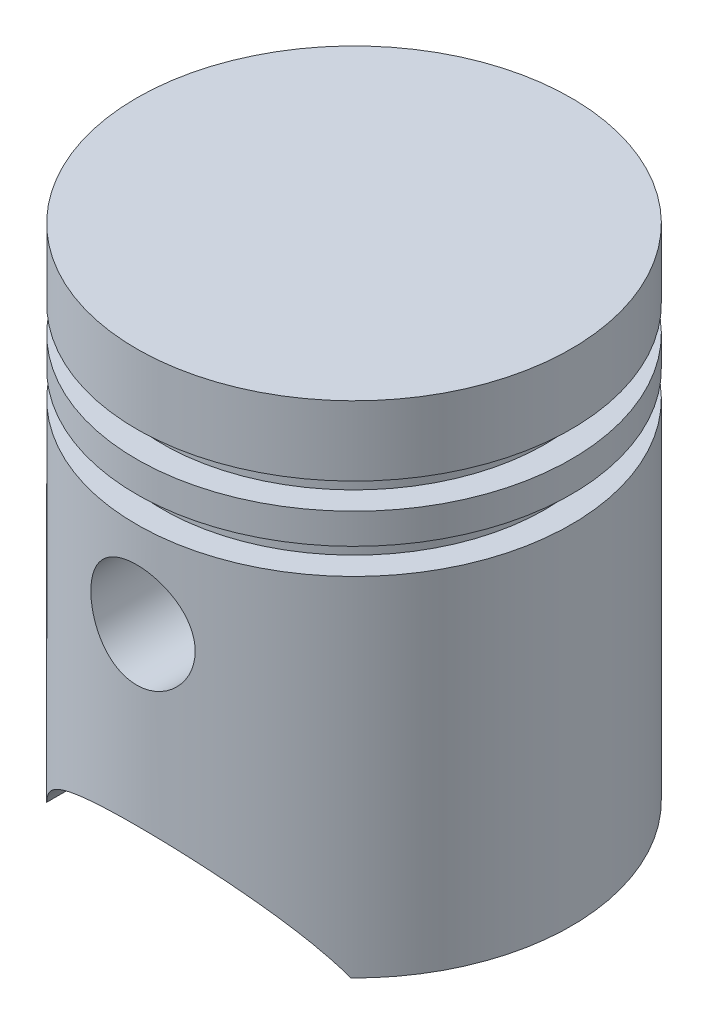
from build123d import *

# Parameters (mm, degrees)
CUT_EXTRUDE1_DEPTH       = 31.5
SKETCH3_R                = 6
CUT_EXTRUDE2_DEPTH       = 31.5
BOSS_EXTRUDE1_REACH      = 73.807
BOSS_EXTRUDE1_END_RADIUS = 23
SKETCH4_R                = 7.5
SKETCH4_R_2              = 6


with BuildPart() as part:
    # Sketch1 → Revolve1 (revolve)
    with BuildSketch(Plane.XY, mode=Mode.PRIVATE) as revolve1_sk:
        Polygon((23, 0), (25, 0), (25, 40), (22, 40), (22, 43), (25, 43), (25, 46.5), (22, 46.5), (22, 49.5), (25, 49.5), (25, 57.5), (0, 57.5), (0, 56.203662834), (23, 56.203662834), (23, 51.5), (20, 51.5), (20, 44.75), (20, 38), (23, 38), align=None)
    revolve(revolve1_sk.sketch.rotate(Axis((0, 63, 0), (0, -1, 0)), 180), axis=Axis((0, 63, 0), (0, -1, 0)))

    # Sketch2 → Cut-Extrude1 (cut, symmetric)
    with BuildSketch(Plane.XY):
        with BuildLine():
            Line((-17.5, 0), (17.5, 0))
            ThreePointArc((17.5, 0), (0, 10), (-17.5, 0))
        make_face()
    extrude(amount=CUT_EXTRUDE1_DEPTH, both=True, mode=Mode.SUBTRACT)

    # Sketch3 → Cut-Extrude2 (cut, symmetric)
    with BuildSketch(Plane.XY):
        with Locations((0, 30)):
            Circle(SKETCH3_R)
    extrude(amount=CUT_EXTRUDE2_DEPTH, both=True, mode=Mode.SUBTRACT)

    # Boss-Extrude1: up to this cylinder (the profile starts inside it)
    boss_extrude1_end = Plane(origin=(0, 30, 0), z_dir=(0, 1, 0)) * Cylinder(BOSS_EXTRUDE1_END_RADIUS, 194.614, mode=Mode.PRIVATE)
    # Sketch4 → Boss-Extrude1 (add, up to the surface)
    with BuildSketch(Plane.XY.offset(10), mode=Mode.PRIVATE) as boss_extrude1_sk1:
        with Locations(Location((0, 30, 0), (0, 0, 180))):
            Circle(SKETCH4_R)
        with Locations((0, 30)):
            Circle(SKETCH4_R_2, mode=Mode.SUBTRACT)
    boss_extrude1_tool1 = extrude(boss_extrude1_sk1.sketch, amount=BOSS_EXTRUDE1_REACH, mode=Mode.PRIVATE) & boss_extrude1_end
    boss_extrude1 = boss_extrude1_tool1.solids().sort_by_distance((7.287868, 30, 10))[0]
    add(boss_extrude1)

    # Mirror1: Boss-Extrude1 across plane
    add(boss_extrude1.mirror(Plane.XY))


solid = part.part
